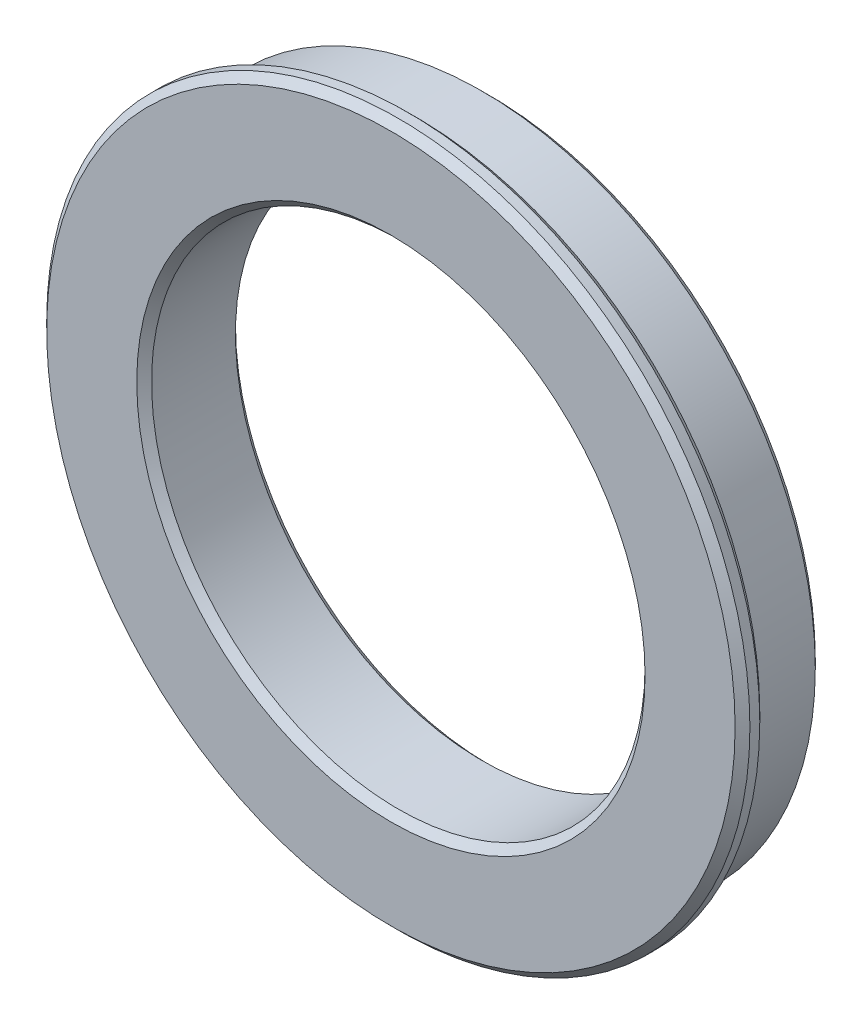
from build123d import *

# Parameters (mm, degrees)
SKETCH_1_R      = 13.5
SKETCH_1_R_2    = 10
EXTRUDE_1_DEPTH = 2
EXTRUDE_START   = -1
SKETCH_2_R      = 14.25
SKETCH_2_R_2    = 10
EXTRUDE_2_DEPTH = 1
CHAMFER_1_SIZE  = 0.3


with BuildPart() as part:
    # 草图1 → 凸台-拉伸1 (new, symmetric)
    with BuildSketch(Plane.XY):
        Circle(SKETCH_1_R)
        Circle(SKETCH_1_R_2, mode=Mode.SUBTRACT)
    extrude(amount=EXTRUDE_1_DEPTH, both=True)

    # 草图2 → 凸台-拉伸2 (add)
    with BuildSketch(Plane.XY.offset(2).offset(EXTRUDE_START)):
        Circle(SKETCH_2_R)
        Circle(SKETCH_2_R_2, mode=Mode.SUBTRACT)
    extrude(amount=EXTRUDE_2_DEPTH)

    # 倒角1
    chamfer_1_edges = [part.edges().sort_by_distance(p)[0] for p in [
        (-14.25, 0, 2),
        (-14.25, 0, 1),
        (-13.5, 0, -2),
        (-10, 0, -2),
        (-10, 0, 2),
    ]]
    chamfer(chamfer_1_edges, length=CHAMFER_1_SIZE)


solid = part.part
